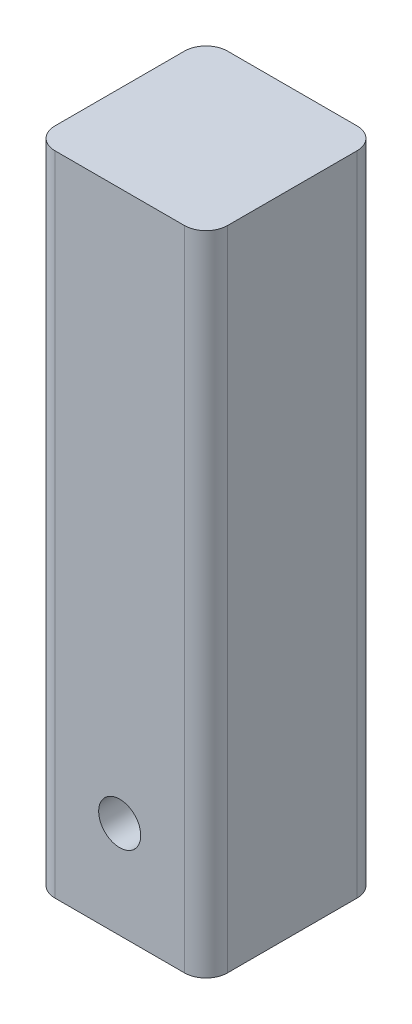
from build123d import *

# Parameters (mm, degrees)
SALIENTE_EXTRUIR1_DEPTH = 120
CROQUIS3_R              = 3.9
CORTAR_EXTRUIR1_DEPTH   = 32


with BuildPart() as part:
    # Croquis2 → Saliente-Extruir1 (new body)
    with BuildSketch(Plane(origin=(0, 0, 0), x_dir=(1, 0, 0), z_dir=(0, 1, 0))):
        with BuildLine():
            Line((-44.836996695, 15.45631068), (-20.836996695, 15.45631068))
            ThreePointArc((-20.836996695, 15.45631068), (-18.00856957, 14.284737804), (-16.836996695, 11.45631068))
            Line((-16.836996695, 11.45631068), (-16.836996695, -12.54368932))
            ThreePointArc((-16.836996695, -12.54368932), (-18.00856957, -15.372116445), (-20.836996695, -16.54368932))
            Line((-20.836996695, -16.54368932), (-44.836996695, -16.54368932))
            ThreePointArc((-44.836996695, -16.54368932), (-47.665423819, -15.372116445), (-48.836996695, -12.54368932))
            Line((-48.836996695, -12.54368932), (-48.836996695, 11.45631068))
            ThreePointArc((-48.836996695, 11.45631068), (-47.665423819, 14.284737804), (-44.836996695, 15.45631068))
        make_face()
    extrude(amount=SALIENTE_EXTRUIR1_DEPTH)

    # Croquis3 → Cortar-Extruir1 (cut)
    with BuildSketch(Plane.XY.offset(16.54368932)):
        with Locations((-32.836996695, 18)):
            Circle(CROQUIS3_R)
    extrude(amount=-CORTAR_EXTRUIR1_DEPTH, mode=Mode.SUBTRACT)


solid = part.part
